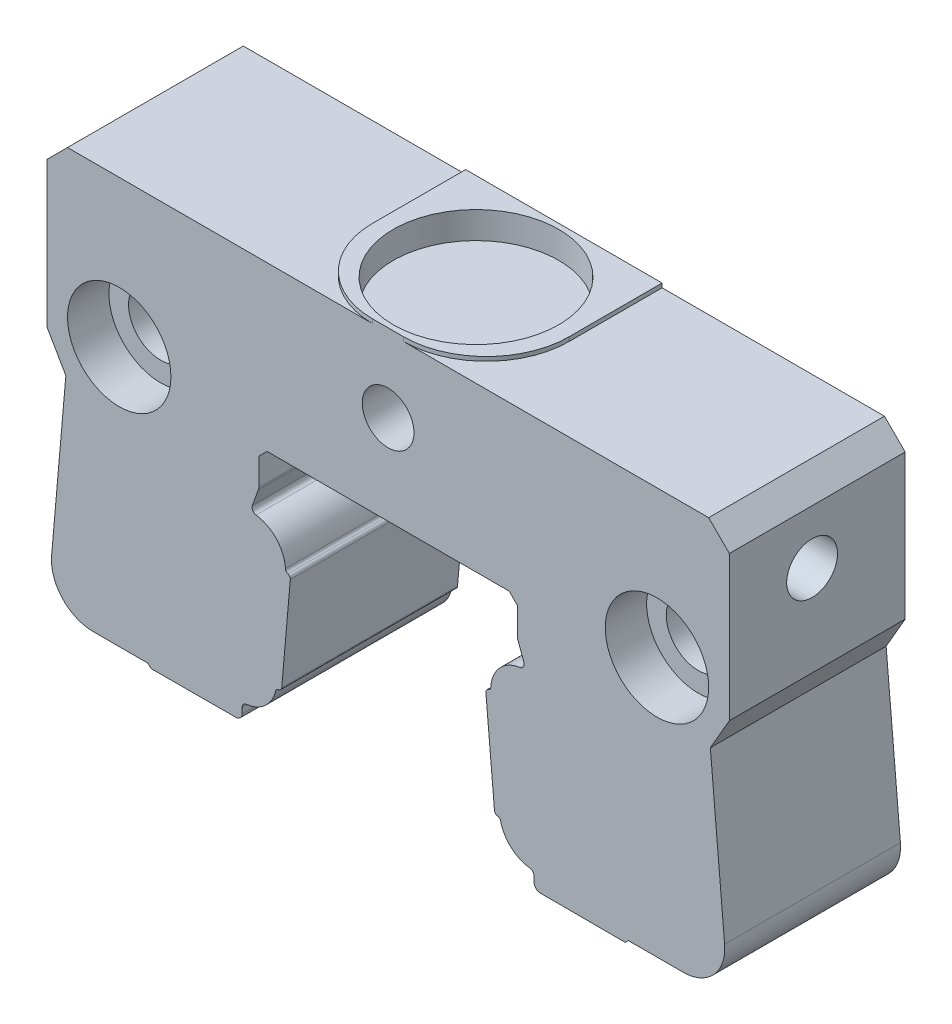
from build123d import *

# Parameters (mm, degrees)
EXTRUDE1_DEPTH                          = 4.25
CBORE_FOR_M5_HEX_HEAD_BOLT2_D           = 3.1
CBORE_FOR_M5_HEX_HEAD_BOLT2_CBORE_D     = 5
CBORE_FOR_M5_HEX_HEAD_BOLT2_CBORE_DEPTH = 2
F_2_5_2_5_DIAMETER_HOLE1_D              = 2.5
F_2_5_2_5_DIAMETER_HOLE1_DEPTH          = 6
F_2_5_2_5_DIAMETER_HOLE1_TIP            = 0.751075774
SKETCH13_R                              = 4
EXTRUDE3_DEPTH                          = 0.2
CUT_EXTRUDE2_START                      = -1.3
SKETCH15_R                              = 4
CUT_EXTRUDE2_DEPTH                      = 1.3
FILLET1_R                               = 0.3
SKETCH16_W                              = 4.5
SKETCH16_H                              = 1.23


with BuildPart() as part:
    # Sketch1 → Extrude1 (new, symmetric)
    with BuildSketch(Plane.XY):
        with BuildLine():
            Line((4.92550995, -3.000896773), (5.340282634, -7.741770244))
            ThreePointArc((5.340282634, -7.741770244), (5.387571197, -7.845597639), (5.489639003, -7.896573115))
            ThreePointArc((5.489639003, -7.896573115), (5.583252131, -7.939368417), (5.635340188, -8.028147299))
            ThreePointArc((5.635340188, -8.028147299), (6.141739158, -8.88598399), (7.051010463, -9.292861611))
            ThreePointArc((7.051010463, -9.292861611), (7.196097182, -9.367838396), (7.25433228, -9.520417385))
            Line((7.25433228, -9.520417385), (7.25433228, -10.089549749))
            Line((7.25433228, -10.089549749), (11.66333313, -10.10000765))
            Line((11.66333313, -10.10000765), (11.81333313, -9.95000765))
            Line((11.81333313, -9.95000765), (14.47525163, -9.95000765))
            ThreePointArc((14.47525163, -9.95000765), (15.889465188, -9.36422121), (16.475251623, -7.95000765))
            ThreePointArc((16.475251623, -7.95000765), (16.473348066, -7.862768875), (16.467641019, -7.775696164))
            Line((16.467641019, -7.775696164), (15.777924964, 0.107794413))
            Line((15.777924964, 0.107794413), (16.697189707, 1.700007653))
            Line((16.697189707, 1.700007653), (16.697189707, 8.700007649))
            Line((16.697189707, 8.700007649), (15.697189707, 9.70000765))
            Line((15.697189707, 9.70000765), (-15.302810298, 9.70000765))
            Line((-15.302810298, 9.70000765), (-16.302810293, 8.700007655))
            Line((-16.302810293, 8.700007655), (-16.302810293, 1.70000765))
            Line((-16.302810293, 1.70000765), (-15.383545551, 0.107794412))
            Line((-15.383545551, 0.107794412), (-16.073261605, -7.775696165))
            ThreePointArc((-16.073261605, -7.775696165), (-15.555426882, -9.301188065), (-14.080872208, -9.95000765))
            Line((-14.080872208, -9.95000765), (-11.418953708, -9.95000765))
            Line((-11.418953708, -9.95000765), (-11.268953705, -10.10000765))
            Line((-11.268953705, -10.10000765), (-6.85995286, -10.089549753))
            Line((-6.85995286, -10.089549753), (-6.85995286, -9.520417385))
            ThreePointArc((-6.85995286, -9.520417385), (-6.801717763, -9.367838396), (-6.656631044, -9.292861611))
            ThreePointArc((-6.656631044, -9.292861611), (-5.747359739, -8.885983989), (-5.240960769, -8.028147299))
            ThreePointArc((-5.240960769, -8.028147299), (-5.188872711, -7.939368417), (-5.095259583, -7.896573115))
            ThreePointArc((-5.095259583, -7.896573115), (-4.993191778, -7.845597639), (-4.945903214, -7.741770244))
            Line((-4.945903214, -7.741770244), (-4.531130531, -3.000896773))
            ThreePointArc((-4.531130531, -3.000896773), (-4.530642578, -2.993452056), (-4.530479824, -2.985993141))
            ThreePointArc((-4.530479824, -2.985993141), (-4.563077813, -2.885564642), (-4.648443372, -2.823425817))
            ThreePointArc((-4.648443372, -2.823425817), (-4.731098063, -2.76492056), (-4.766166593, -2.669921291))
            ThreePointArc((-4.766166593, -2.669921291), (-5.198040021, -1.644927498), (-6.18433448, -1.130777545))
            ThreePointArc((-6.18433448, -1.130777545), (-6.349566009, -1.022272522), (-6.368749921, -0.825532146))
            Line((-6.368749921, -0.825532146), (-6.070902174, -0.007202189))
            ThreePointArc((-6.070902174, -0.007202189), (-6.057367635, 0.043309401), (-6.05280996, 0.095403855))
            Line((-6.05280996, 0.095403855), (-6.05280996, 1.399955293))
            Line((-6.05280996, 1.399955293), (-5.652810289, 1.800007648))
            Line((-5.652810289, 1.800007648), (6.047189708, 1.800007648))
            Line((6.047189708, 1.800007648), (6.44718938, 1.399955292))
            Line((6.44718938, 1.399955292), (6.44718938, 0.095403855))
            ThreePointArc((6.44718938, 0.095403855), (6.451747054, 0.043309401), (6.465281594, -0.007202188))
            Line((6.465281594, -0.007202188), (6.763129341, -0.825532146))
            ThreePointArc((6.763129341, -0.825532146), (6.773460706, -0.864089327), (6.77693973, -0.903854759))
            ThreePointArc((6.77693973, -0.903854759), (6.720404632, -1.054509523), (6.578713899, -1.130777545))
            ThreePointArc((6.578713899, -1.130777545), (5.59241944, -1.644927498), (5.160546013, -2.669921291))
            ThreePointArc((5.160546013, -2.669921291), (5.125477483, -2.76492056), (5.042822792, -2.823425817))
            ThreePointArc((5.042822792, -2.823425817), (4.953208331, -2.891697239), (4.92550995, -3.000896773))
        make_face()
    extrude(amount=EXTRUDE1_DEPTH, both=True)

    # CBORE for M5 Hex Head Bolt2 (through all)
    with Locations(Plane(origin=(-12.802810293, 2.596389855, 4.25), x_dir=(1, 0, 0), z_dir=(0, 0, 1))):
        with Locations((0, 0), (26, 0)):
            CounterBoreHole(CBORE_FOR_M5_HEX_HEAD_BOLT2_D / 2, CBORE_FOR_M5_HEX_HEAD_BOLT2_CBORE_D / 2, CBORE_FOR_M5_HEX_HEAD_BOLT2_CBORE_DEPTH)

    # Ø2.5 (2.5) Diameter Hole1
    with Locations(Plane(origin=(0.197189707, 6.127234967, 4.25), x_dir=(1, 0, 0), z_dir=(0, 0, 1))):
        with Locations((0, 0)):
            Hole(F_2_5_2_5_DIAMETER_HOLE1_D / 2, depth=F_2_5_2_5_DIAMETER_HOLE1_DEPTH)
            with Locations((0, 0, -(F_2_5_2_5_DIAMETER_HOLE1_DEPTH + F_2_5_2_5_DIAMETER_HOLE1_TIP / 2))):  # 118° drill point
                Cone(0, F_2_5_2_5_DIAMETER_HOLE1_D / 2, F_2_5_2_5_DIAMETER_HOLE1_TIP, mode=Mode.SUBTRACT)

    # Sketch13 → Extrude3 (add)
    with BuildSketch(Plane(origin=(0, 9.70000765, 0), x_dir=(1, 0, 0), z_dir=(0, 1, 0))):
        with BuildLine():
            Line((-4.552810293, 4.25), (-4.552810293, -0.25))
            ThreePointArc((-4.552810293, -0.25), (-3.381237418, -3.078427125), (-0.552810293, -4.25))
            Line((-0.552810293, -4.25), (0.947189707, -4.25))
            ThreePointArc((0.947189707, -4.25), (3.775616832, -3.078427125), (4.947189707, -0.25))
            Line((4.947189707, -0.25), (4.947189707, 4.25))
            Line((4.947189707, 4.25), (-4.552810293, 4.25))
        make_face()
        with Locations(Location((0.197189707, 0, 0), (0, 0, 270))):
            Circle(SKETCH13_R, mode=Mode.SUBTRACT)
    extrude(amount=EXTRUDE3_DEPTH)

    # Sketch15 → Cut-Extrude2 (cut)
    with BuildSketch(Plane(origin=(0, 9.90000765, 0), x_dir=(1, 0, 0), z_dir=(0, 1, 0)).offset(CUT_EXTRUDE2_START)):
        with Locations(Location((0.197189707, 0, 0), (0, 0, 270))):
            Circle(SKETCH15_R)
    extrude(amount=CUT_EXTRUDE2_DEPTH, mode=Mode.SUBTRACT)

    # Fillet1
    fillet1_edges = [part.edges().sort_by_distance(p)[0] for p in [
        (-6.85995286, -10.089549753, 0),
        (7.25433228, -10.089549749, 0),
    ]]
    fillet(fillet1_edges, radius=FILLET1_R)

    # Sketch16 → Cut-Revolve1 (revolve, cut)
    with BuildSketch(Plane(origin=(0.014534484, 6.127668215, 0), x_dir=(0.9999971869535607, -0.0023719369649562337, 0), z_dir=(-0.0023719369649562337, -0.9999971869535607, 0)), mode=Mode.PRIVATE) as cut_revolve1_sk:
        with Locations((14.443110426, 0.865)):
            Rectangle(SKETCH16_W, SKETCH16_H)
        with Locations((-14.073400302, 0.865)):
            Rectangle(SKETCH16_W, SKETCH16_H)
    revolve(cut_revolve1_sk.sketch.rotate(Axis((-24.587443164, 6.186022719, 0.25), (0.9999971869535605, -0.002371936964956225, 0)), 90), axis=Axis((-24.587443164, 6.186022719, 0.25), (0.9999971869535605, -0.002371936964956225, 0)), mode=Mode.SUBTRACT)


solid = part.part
